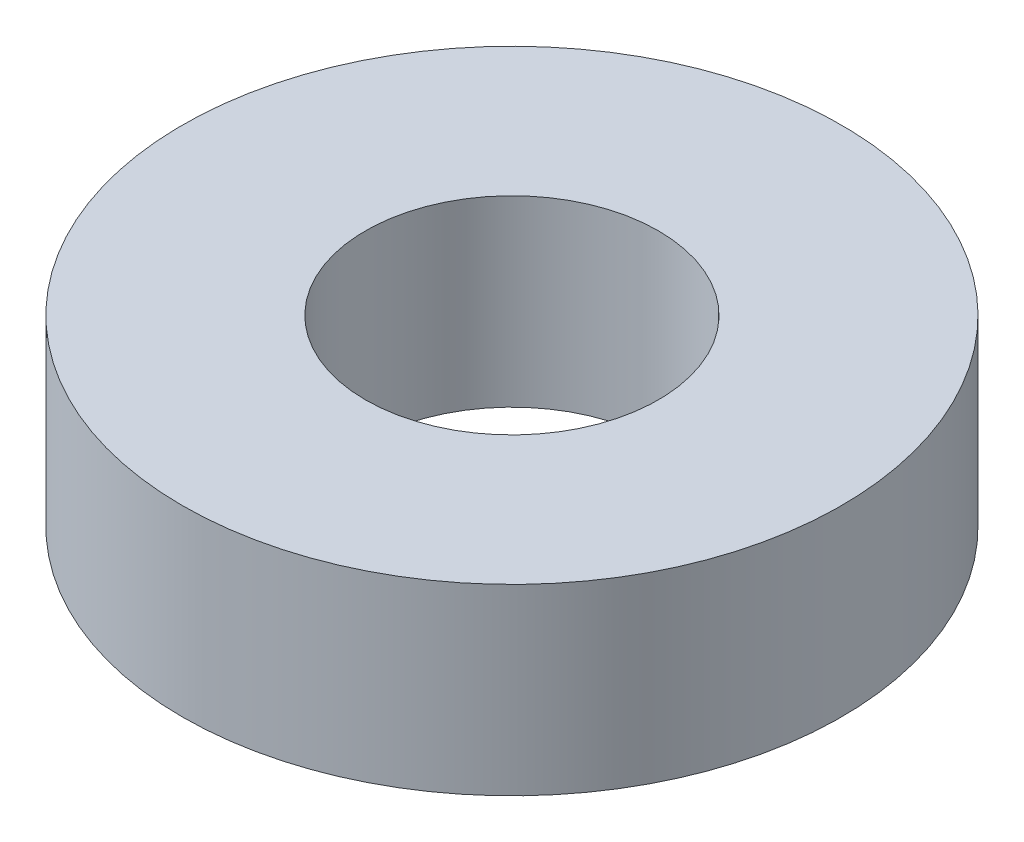
from build123d import *

# Parameters (mm, degrees)
SKETCH1_R           = 14.2875
SKETCH1_R_2         = 6.35
BOSS_EXTRUDE1_DEPTH = 7.9375


with BuildPart() as part:
    # Sketch1 → Boss-Extrude1 (new body)
    with BuildSketch(Plane(origin=(0, 0, 0), x_dir=(1, 0, 0), z_dir=(0, 1, 0))):
        with Locations(Location((0, 0, 0), (0, 0, 270))):
            Circle(SKETCH1_R)
        with Locations(Location((0, 0, 0), (0, 0, 270))):
            Circle(SKETCH1_R_2, mode=Mode.SUBTRACT)
    extrude(amount=BOSS_EXTRUDE1_DEPTH)


solid = part.part
